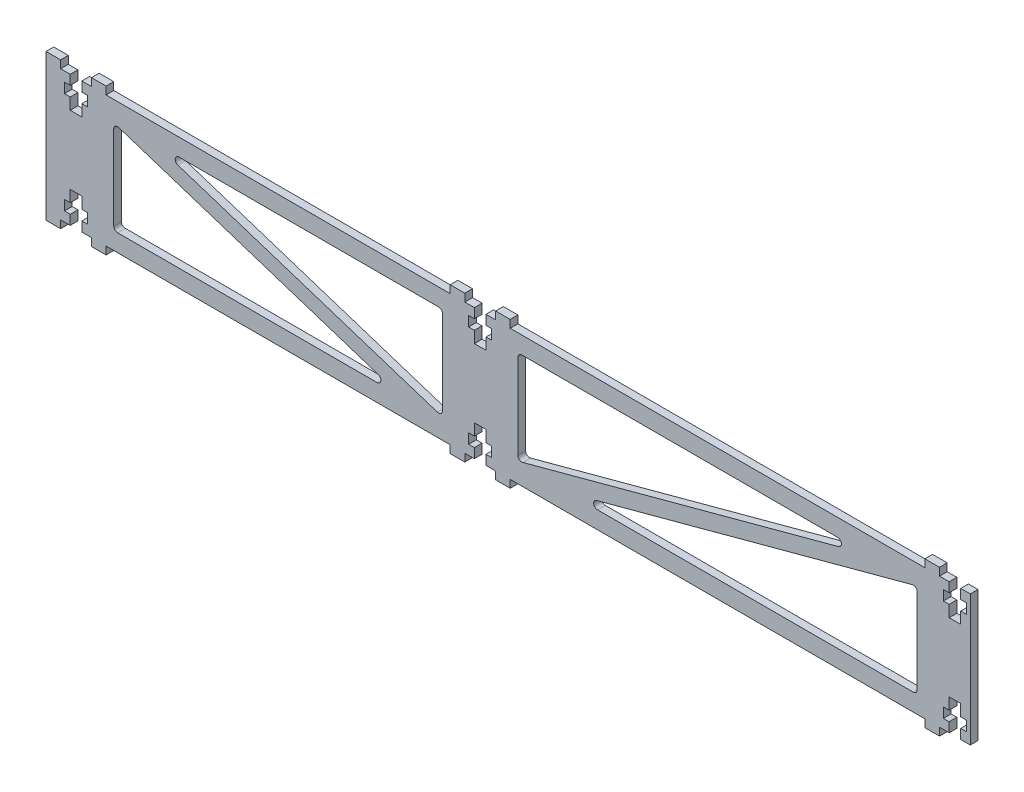
from build123d import *

# Parameters (mm, degrees)
EXTRUDE_1_DEPTH = 2


with BuildPart() as part:
    # 草图2 → 凸台-拉伸1 (new body)
    with BuildSketch(Plane.XY):
        Polygon((-15.2, 6.5), (74.2, 6.5), (74.2, 8.5), (78, 8.5), (78, 6.5), (80.5, 6.5), (80.5, 4), (79, 4), (79, 1.4), (80.5, 1.4), (80.5, -1.6), (83.5, -1.6), (83.5, 1.4), (85, 1.4), (85, 4), (83.5, 4), (83.5, 6.5), (86, 6.5), (86, 8.5), (89.8, 8.5), (89.8, 6.5), (197.54, 6.5), (197.54, 8.5), (201.34, 8.5), (201.34, 6.5), (203.84, 6.5), (203.84, 4), (202.34, 4), (202.34, 1.4), (203.84, 1.4), (203.84, -1.6), (206.84, -1.6), (206.84, 1.4), (208.34, 1.4), (208.34, 4), (206.84, 4), (206.84, 6.5), (209.34, 6.5), (209.34, -27.5), (206.84, -27.5), (206.84, -25), (208.34, -25), (208.34, -22.4), (206.84, -22.4), (206.84, -19.4), (203.84, -19.4), (203.84, -22.4), (202.34, -22.4), (202.34, -25), (203.84, -25), (203.84, -27.5), (201.34, -27.5), (201.34, -29.5), (197.54, -29.5), (197.54, -27.5), (89.8, -27.5), (89.8, -29.5), (86, -29.5), (86, -27.5), (83.5, -27.5), (83.5, -25), (85, -25), (85, -22.4), (83.5, -22.4), (83.5, -19.4), (80.5, -19.4), (80.5, -22.4), (79, -22.4), (79, -25), (80.5, -25), (80.5, -27.5), (78, -27.5), (78, -29.5), (74.2, -29.5), (74.2, -27.5), (-15.2, -27.5), (-15.2, -29.5), (-19, -29.5), (-19, -27.5), (-21.5, -27.5), (-21.5, -25), (-20, -25), (-20, -22.4), (-21.5, -22.4), (-21.5, -19.4), (-24.5, -19.4), (-24.5, -22.4), (-26, -22.4), (-26, -25), (-24.5, -25), (-24.5, -27.5), (-27, -27.5), (-27, -29.5), (-30.8, -29.5), (-30.8, 8.5), (-27, 8.5), (-27, 6.5), (-24.5, 6.5), (-24.5, 4), (-26, 4), (-26, 1.4), (-24.5, 1.4), (-24.5, -1.6), (-21.5, -1.6), (-21.5, 1.4), (-20, 1.4), (-20, 4), (-21.5, 4), (-21.5, 6.5), (-19, 6.5), (-19, 8.5), (-15.2, 8.5), align=None)
        with BuildLine():
            Line((3.770961007, 2), (71.2, 2))
            ThreePointArc((71.2, 2), (71.907106781, 1.707106781), (72.2, 1))
            Line((72.2, 1), (72.2, -20.872954483))
            ThreePointArc((72.2, -20.872954483), (71.787980979, -21.681829238), (70.891443263, -21.824160423))
            Line((70.891443263, -21.824160423), (3.46240427, 0.04879406))
            ThreePointArc((3.46240427, 0.04879406), (2.783234845, 1.156195487), (3.770961007, 2))
        make_face(mode=Mode.SUBTRACT)
        with BuildLine():
            Line((92.8, 2), (174.852275232, 2))
            ThreePointArc((174.852275232, 2), (175.843645832, 1.131089029), (175.11219085, 0.034368667))
            Line((175.11219085, 0.034368667), (93.059915618, -22.051356057))
            ThreePointArc((93.059915618, -22.051356057), (92.191689067, -21.879423539), (91.8, -21.085724724))
            Line((91.8, -21.085724724), (91.8, 1))
            ThreePointArc((91.8, 1), (92.092893219, 1.707106781), (92.8, 2))
        make_face(mode=Mode.SUBTRACT)
        with BuildLine():
            Line((112.22780915, -21.034368667), (194.280084382, 1.051356057))
            ThreePointArc((194.280084382, 1.051356057), (195.148310933, 0.879423539), (195.54, 0.085724724))
            Line((195.54, 0.085724724), (195.54, -22))
            ThreePointArc((195.54, -22), (195.247106781, -22.707106781), (194.54, -23))
            Line((194.54, -23), (112.487724768, -23))
            ThreePointArc((112.487724768, -23), (111.496354168, -22.131089029), (112.22780915, -21.034368667))
        make_face(mode=Mode.SUBTRACT)
        with BuildLine():
            Line((-13.2, -0.127045517), (-13.2, -22))
            ThreePointArc((-13.2, -22), (-12.907106781, -22.707106781), (-12.2, -23))
            Line((-12.2, -23), (55.229038993, -23))
            ThreePointArc((55.229038993, -23), (56.216765155, -22.156195487), (55.53759573, -21.04879406))
            Line((55.53759573, -21.04879406), (-11.891443263, 0.824160423))
            ThreePointArc((-11.891443263, 0.824160423), (-12.787980979, 0.681829238), (-13.2, -0.127045517))
        make_face(mode=Mode.SUBTRACT)
    extrude(amount=EXTRUDE_1_DEPTH)


solid = part.part
